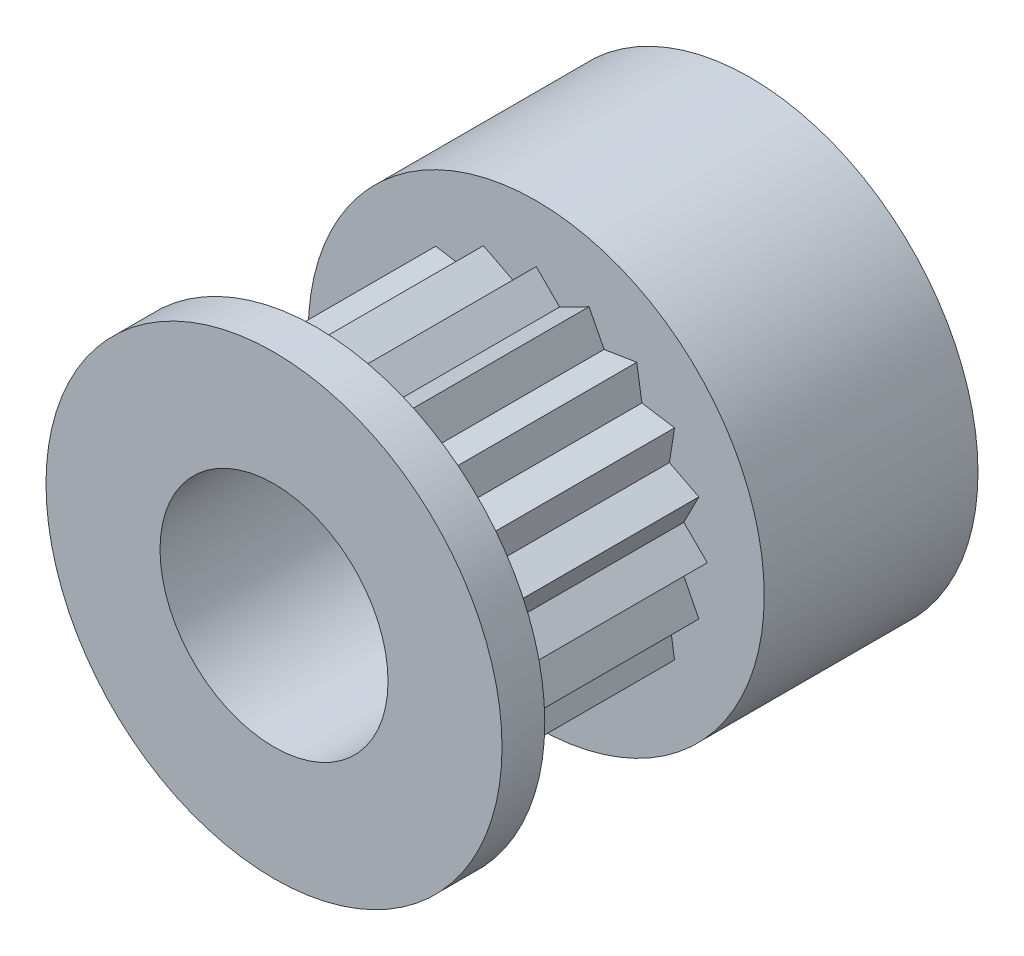
from build123d import *

# Parameters (mm, degrees)
SKETCH1_R           = 8
BOSS_EXTRUDE1_DEPTH = 7.5
BOSS_EXTRUDE2_DEPTH = 7.7
SKETCH3_R           = 8
BOSS_EXTRUDE3_DEPTH = 1.5
SKETCH4_R           = 4
CUT_EXTRUDE2_DEPTH  = 17.5


with BuildPart() as part:
    # Sketch1 → Boss-Extrude1 (new body)
    with BuildSketch(Plane.XY):
        Circle(SKETCH1_R)
    extrude(amount=BOSS_EXTRUDE1_DEPTH)

    # Sketch2 → Boss-Extrude2 (add)
    with BuildSketch(Plane.XY.offset(7.5)):
        Polygon((-0.820372416, 5.179627584), (0, 6), (0.820372416, 5.179627584), (1.854101966, 5.706339098), (2.38081348, 4.672609548), (3.526711514, 4.854101966), (3.708203932, 3.708203933), (4.854101966, 3.526711514), (4.672609548, 2.38081348), (5.706339098, 1.854101966), (5.179627584, 0.820372416), (6, 0), (5.179627584, -0.820372416), (5.706339098, -1.854101966), (4.672609548, -2.38081348), (4.854101966, -3.526711514), (3.708203933, -3.708203932), (3.526711514, -4.854101966), (2.38081348, -4.672609548), (1.854101966, -5.706339098), (0.820372416, -5.179627584), (0, -6), (-0.820372416, -5.179627584), (-1.854101966, -5.706339098), (-2.38081348, -4.672609548), (-3.526711514, -4.854101966), (-3.708203932, -3.708203932), (-4.854101966, -3.526711514), (-4.672609548, -2.38081348), (-5.706339098, -1.854101966), (-5.179627584, -0.820372416), (-6, 0), (-5.179627584, 0.820372416), (-5.706339098, 1.854101966), (-4.672609548, 2.38081348), (-4.854101966, 3.526711514), (-3.708203932, 3.708203932), (-3.526711514, 4.854101966), (-2.38081348, 4.672609548), (-1.854101966, 5.706339098), align=None)
    extrude(amount=BOSS_EXTRUDE2_DEPTH)

    # Sketch3 → Boss-Extrude3 (add)
    with BuildSketch(Plane.XY.offset(15.2)):
        Circle(SKETCH3_R)
    extrude(amount=BOSS_EXTRUDE3_DEPTH)

    # Sketch4 → Cut-Extrude2 (cut)
    with BuildSketch(Plane.XY.offset(16.7)):
        Circle(SKETCH4_R)
    extrude(amount=-CUT_EXTRUDE2_DEPTH, mode=Mode.SUBTRACT)


solid = part.part
